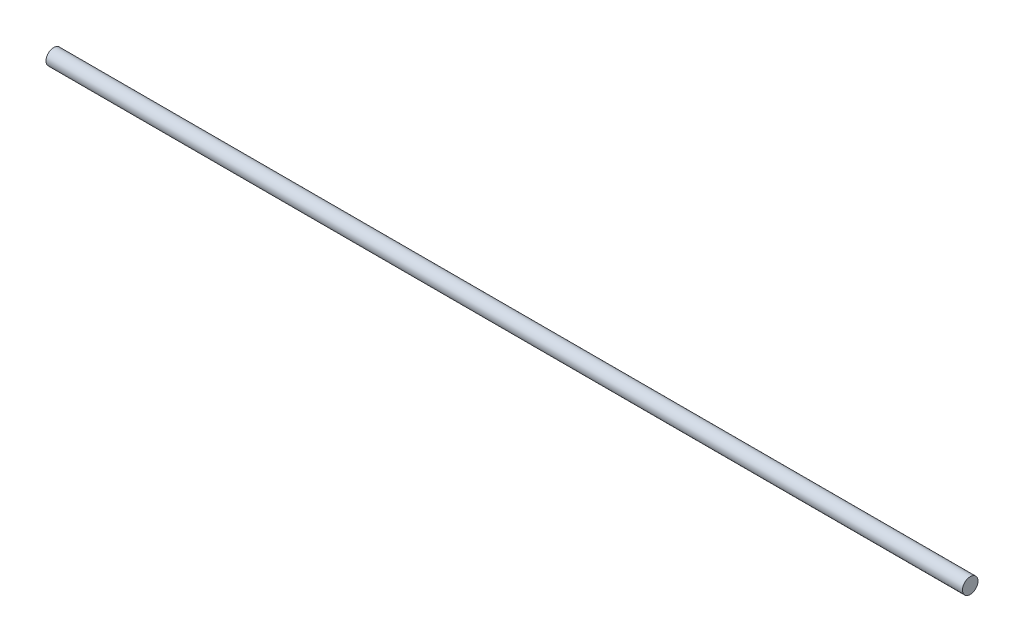
from build123d import *

# Parameters (mm, degrees)
SKETCH1_R           = 5
BOSS_EXTRUDE1_DEPTH = 590


with BuildPart() as part:
    # Sketch1 → Boss-Extrude1 (new body)
    with BuildSketch(Plane(origin=(0, 0, 0), x_dir=(0, 0, -1), z_dir=(1, 0, 0))):
        Circle(SKETCH1_R)
    extrude(amount=BOSS_EXTRUDE1_DEPTH)


solid = part.part
